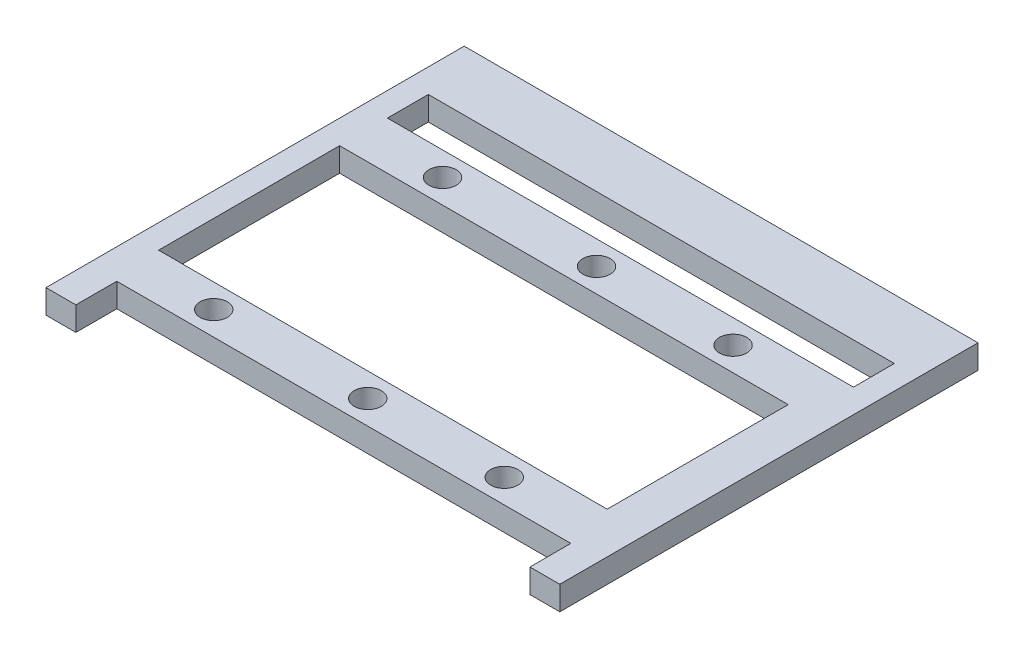
from build123d import *

# Parameters (mm, degrees)
SKETCH2_R           = 2.275
SKETCH2_W           = 75.079254151
SKETCH2_H           = 30.3
BOSS_EXTRUDE1_DEPTH = 4
SKETCH3_W           = 86
SKETCH3_H           = 4
BOSS_EXTRUDE2_DEPTH = 10


with BuildPart() as part:
    # Sketch2 → Boss-Extrude1 (new body)
    with BuildSketch(Plane(origin=(0, 0, 0), x_dir=(1, 0, 0), z_dir=(0, 1, 0))):
        Polygon((43, 30), (39, 30), (39, 23.15), (-39, 23.15), (-39, 30), (-43, 30), (-43, -30), (-38, -30), (-38, -23.15), (38, -23.15), (38, -30), (43, -30), align=None)
        with Locations(Location((-25.775, 19.15, 0), (0, 0, 270))):
            Circle(SKETCH2_R, mode=Mode.SUBTRACT)
        with Locations(Location((22.854254151, 19.15, 0), (0, 0, 270))):
            Circle(SKETCH2_R, mode=Mode.SUBTRACT)
        with Locations(Location((0, 19.15, 0), (0, 0, 270))):
            Circle(SKETCH2_R, mode=Mode.SUBTRACT)
        with Locations(Location((22.854254151, -19.15, 0), (0, 0, 90))):
            Circle(SKETCH2_R, mode=Mode.SUBTRACT)
        with Locations(Location((0, -19.15, 0), (0, 0, 90))):
            Circle(SKETCH2_R, mode=Mode.SUBTRACT)
        with Locations(Location((-25.775, -19.15, 0), (0, 0, 90))):
            Circle(SKETCH2_R, mode=Mode.SUBTRACT)
        with Locations((-1.460372924, 0)):
            Rectangle(SKETCH2_W, SKETCH2_H, mode=Mode.SUBTRACT)
    extrude(amount=BOSS_EXTRUDE1_DEPTH)

    # Sketch3 → Boss-Extrude2 (add)
    with BuildSketch(Plane(origin=(0, 0, -30), x_dir=(-1, 0, 0), z_dir=(0, 0, -1))):
        with Locations((0, 2)):
            Rectangle(SKETCH3_W, SKETCH3_H)
    extrude(amount=BOSS_EXTRUDE2_DEPTH)


solid = part.part
